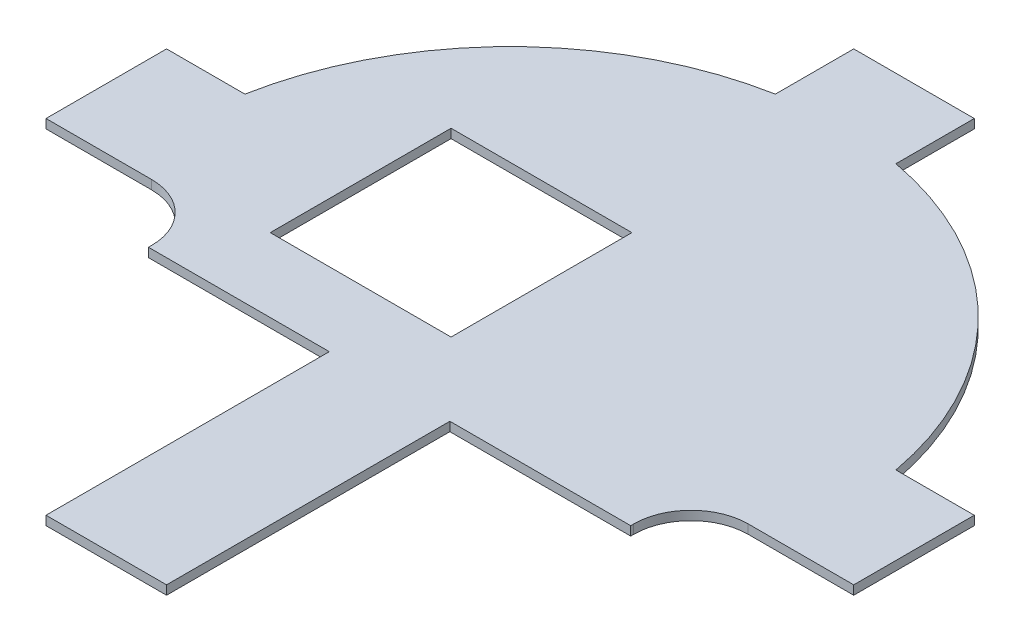
from build123d import *

# Parameters (mm, degrees)
SALIENTE_EXTRUIR1_DEPTH = 1.5
CROQUIS2_W              = 30
CROQUIS2_H              = 30
CORTAR_EXTRUIR1_DEPTH   = 123.41919068


with BuildPart() as part:
    # Croquis1 → Saliente-Extruir1 (new body)
    with BuildSketch(Plane(origin=(0, 0, 0), x_dir=(1, 0, 0), z_dir=(0, 1, 0))):
        with BuildLine():
            Line((-10.354497354, 18.78659612), (-10.354497354, -55.21340388))
            Line((-10.354497354, -55.21340388), (-10.354497354, -102.21340388))
            Line((-10.354497354, -102.21340388), (9.645502646, -102.21340388))
            Line((9.645502646, -102.21340388), (9.645502646, -55.21340388))
            Line((9.645502646, -55.21340388), (9.645502646, 18.78659612))
            ThreePointArc((9.645502646, 18.78659612), (-0.354497354, 19.704716991), (-10.354497354, 18.78659612))
        make_face()
        with BuildLine():
            ThreePointArc((53.645502646, -25.21340388), (38.478478323, 3.619571798), (9.645502646, 18.78659612))
            Line((9.645502646, 18.78659612), (9.645502646, -55.21340388))
            Line((9.645502646, -55.21340388), (39.645502646, -55.21340388))
            Line((39.645502646, -55.21340388), (39.645502646, -54.71340388))
            ThreePointArc((39.645502646, -54.71340388), (42.427988224, -47.995889459), (49.145502646, -45.21340388))
            Line((49.145502646, -45.21340388), (66.645502646, -45.21340388))
            Line((66.645502646, -45.21340388), (66.645502646, -25.21340388))
            Line((66.645502646, -25.21340388), (53.645502646, -25.21340388))
        make_face()
        with BuildLine():
            Line((-40.354497354, -54.71340388), (-40.354497354, -55.21340388))
            Line((-40.354497354, -55.21340388), (-10.354497354, -55.21340388))
            Line((-10.354497354, -55.21340388), (-10.354497354, 18.78659612))
            ThreePointArc((-10.354497354, 18.78659612), (-39.187473032, 3.619571798), (-54.354497354, -25.21340388))
            Line((-54.354497354, -25.21340388), (-67.354497354, -25.21340388))
            Line((-67.354497354, -25.21340388), (-67.354497354, -45.21340388))
            Line((-67.354497354, -45.21340388), (-49.854497354, -45.21340388))
            ThreePointArc((-49.854497354, -45.21340388), (-43.136982933, -47.995889459), (-40.354497354, -54.71340388))
        make_face()
        with BuildLine():
            Line((-10.354497354, 31.78659612), (-10.354497354, 18.78659612))
            ThreePointArc((-10.354497354, 18.78659612), (-0.354497354, 19.704716991), (9.645502646, 18.78659612))
            Line((9.645502646, 18.78659612), (9.645502646, 31.78659612))
            Line((9.645502646, 31.78659612), (-10.354497354, 31.78659612))
        make_face()
    extrude(amount=SALIENTE_EXTRUIR1_DEPTH)

    # Croquis2 → Cortar-Extruir1 (cut, through all)
    with BuildSketch(Plane(origin=(0, 1.5, 0), x_dir=(1, 0, 0), z_dir=(0, 1, 0))):
        with Locations((-17.354497354, -28.01340388)):
            Rectangle(CROQUIS2_W, CROQUIS2_H)
    extrude(amount=-CORTAR_EXTRUIR1_DEPTH, mode=Mode.SUBTRACT)


solid = part.part
